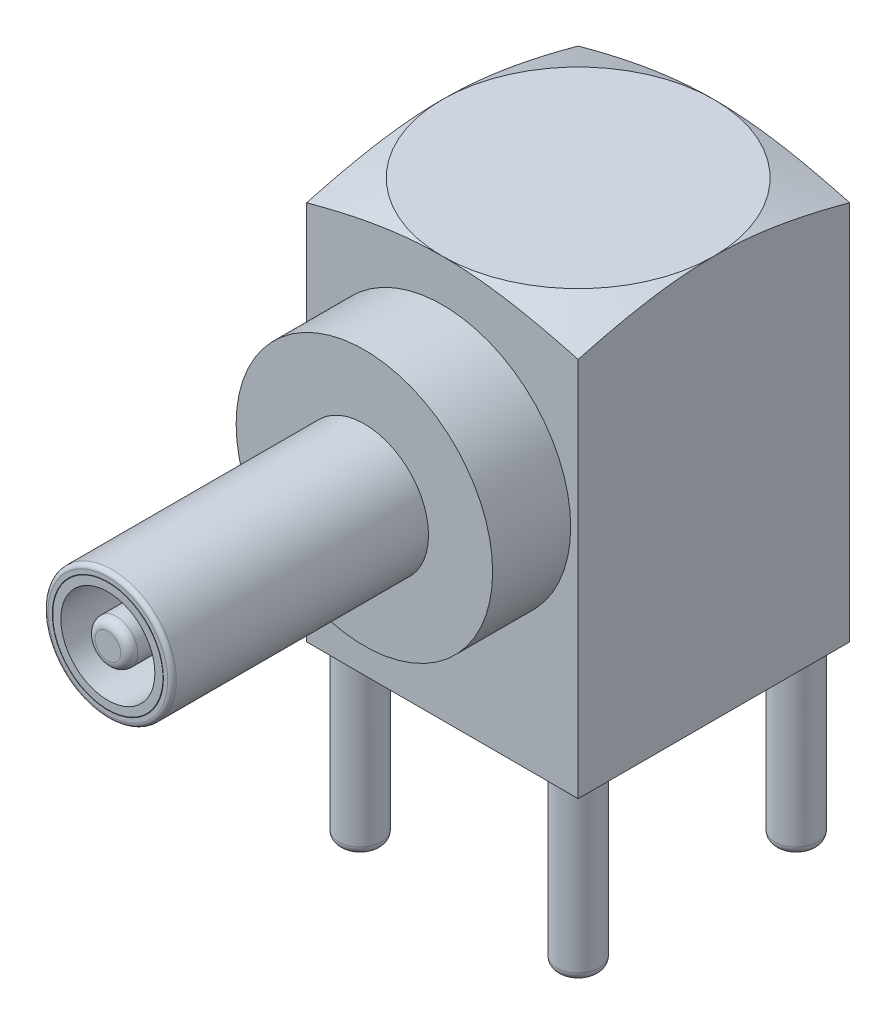
from build123d import *

# Parameters (mm, degrees)
SKETCH_2_W      = 6.35
SKETCH_2_H      = 6.35
EXTRUDE_1_DEPTH = 9.4
SKETCH_6_R      = 3
EXTRUDE_2_DEPTH = 5
SKETCH_7_R      = 1.5
SKETCH_7_R_2    = 1.3
EXTRUDE_3_DEPTH = 6
SKETCH2_R       = 1.5
EXTRUDE1_DEPTH  = 8
SKETCH3_R       = 1.49
EXTRUDE3_DEPTH  = 8
SKETCH_R        = 1.49
EXTRUDE4_DEPTH  = 8
SKETCH4_R       = 0.5
EXTRUDE5_DEPTH  = 4
SKETCH5_R       = 0.5
EXTRUDE9_DEPTH  = 4
SKETCH6_R       = 1.29
EXTRUDE10_DEPTH = 6
SKETCH7_R       = 1.1
EXTRUDE11_DEPTH = 8
SKETCH8_R       = 0.5
EXTRUDE12_DEPTH = 8
FILLET1_R       = 0.2
FILLET2_R       = 0.1
FILLET3_R       = 0.2


with BuildPart() as part:
    # 草图2 → 凸台-拉伸1 (new body)
    with BuildSketch(Plane(origin=(0, 0, 0), x_dir=(1, 0, 0), z_dir=(0, 1, 0))):
        Rectangle(SKETCH_2_W, SKETCH_2_H)
    extrude(amount=EXTRUDE_1_DEPTH)

    # 草图5 → 切除-旋转1 (revolve, cut)
    with BuildSketch(Plane.XY):
        Polygon((3.175, 9.4), (5.248872861, 14.588450108), (5.248872861, 8.60417478), align=None)
    revolve(axis=Axis((0, 15.427678148, 0), (0, -1, 0)), mode=Mode.SUBTRACT)

    # 草图6 → 凸台-拉伸2 (add)
    with BuildSketch(Plane.XY):
        with Locations((0, 5.416720089)):
            Circle(SKETCH_6_R)
    extrude(amount=EXTRUDE_2_DEPTH)

    # 草图7 → 凸台-拉伸3 (add)
    with BuildSketch(Plane.XY.offset(5)):
        with Locations((0, 5.416720089)):
            Circle(SKETCH_7_R)
        with Locations((0, 5.416720089)):
            Circle(SKETCH_7_R_2, mode=Mode.SUBTRACT)
    extrude(amount=EXTRUDE_3_DEPTH)

    # Sketch2 → Extrude1 (cut)
    with BuildSketch(Plane.XZ):
        Circle(SKETCH2_R)
    extrude(amount=-EXTRUDE1_DEPTH, mode=Mode.SUBTRACT)

    # Sketch3 → Extrude3 (add)
    with BuildSketch(Plane.XZ.offset(-8)):
        Circle(SKETCH3_R)
    extrude(amount=EXTRUDE3_DEPTH)

    # Sketch → Extrude4 (add)
    with BuildSketch(Plane.XZ.offset(-8)):
        Circle(SKETCH_R)
    extrude(amount=EXTRUDE4_DEPTH)

    # Sketch4 → Extrude5 (add)
    with BuildSketch(Plane.XZ):
        Circle(SKETCH4_R)
    extrude(amount=EXTRUDE5_DEPTH)

    # Sketch5 → Extrude9 (add)
    with BuildSketch(Plane.XZ):
        with Locations((-2.55, 2.55)):
            Circle(SKETCH5_R)
        with Locations((-2.55, -2.55)):
            Circle(SKETCH5_R)
        with Locations((2.55, -2.55)):
            Circle(SKETCH5_R)
        with Locations((2.55, 2.55)):
            Circle(SKETCH5_R)
    extrude(amount=EXTRUDE9_DEPTH)

    # Sketch6 → Extrude10 (add)
    with BuildSketch(Plane.XY.offset(5)):
        with Locations((0, 5.416720089)):
            Circle(SKETCH6_R)
    extrude(amount=EXTRUDE10_DEPTH)

    # Sketch7 → Extrude11 (cut)
    with BuildSketch(Plane.XY.offset(11)):
        with Locations((0, 5.416720089)):
            Circle(SKETCH7_R)
    extrude(amount=-EXTRUDE11_DEPTH, mode=Mode.SUBTRACT)

    # Sketch8 → Extrude12 (add)
    with BuildSketch(Plane.XY.offset(3)):
        with Locations((0, 5.416720089)):
            Circle(SKETCH8_R)
    extrude(amount=EXTRUDE12_DEPTH)

    # Fillet1
    fillet1_edges = [part.edges().sort_by_distance(p)[0] for p in [
        (-0.5, 5.416720089, 11),
    ]]
    fillet(fillet1_edges, radius=FILLET1_R)

    # Fillet2
    fillet2_edges = [part.edges().sort_by_distance(p)[0] for p in [
        (-1.5, 5.416720089, 11),
    ]]
    fillet(fillet2_edges, radius=FILLET2_R)

    # Fillet3
    fillet3_edges = [part.edges().sort_by_distance(p)[0] for p in [
        (-0.5, -4, 0),
        (2.05, -4, -2.55),
        (-3.05, -4, -2.55),
        (2.05, -4, 2.55),
        (-3.05, -4, 2.55),
    ]]
    fillet(fillet3_edges, radius=FILLET3_R)


solid = part.part
